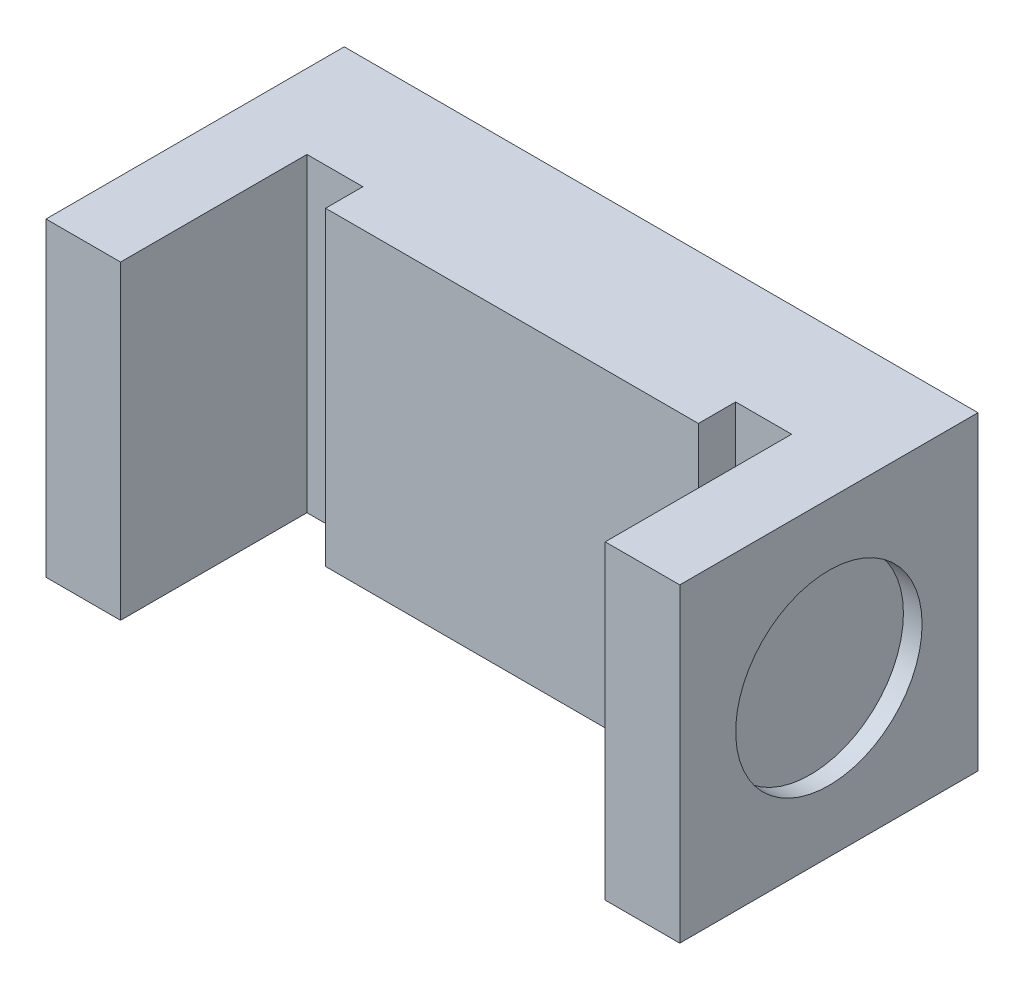
from build123d import *

# Parameters (mm, degrees)
SKETCH1_W           = 130
SKETCH1_H           = 83.238396624
BOSS_EXTRUDE1_DEPTH = 30
SKETCH2_W           = 100
SKETCH2_H           = 83.238396624
BOSS_EXTRUDE2_DEPTH = 10
SKETCH3_W           = 80
SKETCH3_H           = 83.238396624
BOSS_EXTRUDE3_DEPTH = 20
SKETCH4_R           = 25
CUT_EXTRUDE1_DEPTH  = 5
SKETCH5_W           = 80
SKETCH5_H           = 83.238396624
BOSS_EXTRUDE4_DEPTH = 20
CUT_EXTRUDE2_START  = -5
SKETCH6_R           = 25
CUT_EXTRUDE2_DEPTH  = 5
SKETCH7_W           = 80
SKETCH7_H           = 20
BOSS_EXTRUDE5_DEPTH = 5
SKETCH8_W           = 85
SKETCH8_H           = 50
BOSS_EXTRUDE6_DEPTH = 30
SKETCH9_W           = 85
SKETCH9_H           = 25
CUT_EXTRUDE3_DEPTH  = 15
SKETCH10_W          = 30
SKETCH10_H          = 15
CUT_EXTRUDE4_DEPTH  = 128.630488655


with BuildPart() as part:
    # Sketch1 → Boss-Extrude1 (new body)
    with BuildSketch(Plane.XY):
        Rectangle(SKETCH1_W, SKETCH1_H)
    extrude(amount=BOSS_EXTRUDE1_DEPTH)

    # Sketch2 → Boss-Extrude2 (add)
    with BuildSketch(Plane.XY.offset(30)):
        Rectangle(SKETCH2_W, SKETCH2_H)
    extrude(amount=BOSS_EXTRUDE2_DEPTH)

    # Sketch3 → Boss-Extrude3 (add)
    with BuildSketch(Plane.ZY.offset(65)):
        with Locations((40, 0)):
            Rectangle(SKETCH3_W, SKETCH3_H)
    extrude(amount=BOSS_EXTRUDE3_DEPTH)

    # Sketch4 → Cut-Extrude1 (cut)
    with BuildSketch(Plane.ZY.offset(85)):
        with Locations((40, 0)):
            Circle(SKETCH4_R)
    extrude(amount=-CUT_EXTRUDE1_DEPTH, mode=Mode.SUBTRACT)

    # Sketch5 → Boss-Extrude4 (add)
    with BuildSketch(Plane(origin=(65, 0, 0), x_dir=(0, 0, -1), z_dir=(1, 0, 0))):
        with Locations((-40, 0)):
            Rectangle(SKETCH5_W, SKETCH5_H)
    extrude(amount=BOSS_EXTRUDE4_DEPTH)

    # Sketch6 → Cut-Extrude2 (cut)
    with BuildSketch(Plane(origin=(85, 0, 0), x_dir=(0, 0, -1), z_dir=(1, 0, 0)).offset(CUT_EXTRUDE2_START)):
        with Locations(Location((-40, 0, 0), (0, 0, 180))):
            Circle(SKETCH6_R)
    extrude(amount=CUT_EXTRUDE2_DEPTH, mode=Mode.SUBTRACT)

    # Sketch7 → Boss-Extrude5 (add)
    with BuildSketch(Plane(origin=(0, 0, 0), x_dir=(-1, 0, 0), z_dir=(0, 0, -1))):
        with Locations((0, -41.619198312)):
            Rectangle(SKETCH7_W, SKETCH7_H)
    extrude(amount=BOSS_EXTRUDE5_DEPTH)

    # Sketch8 → Boss-Extrude6 (add)
    with BuildSketch(Plane(origin=(0, 0, 0), x_dir=(-1, 0, 0), z_dir=(0, 0, -1))):
        Rectangle(SKETCH8_W, SKETCH8_H)
    extrude(amount=BOSS_EXTRUDE6_DEPTH)

    # Sketch9 → Cut-Extrude3 (cut)
    with BuildSketch(Plane(origin=(0, 0, -30), x_dir=(-1, 0, 0), z_dir=(0, 0, -1))):
        with Locations((0, 12.5)):
            Rectangle(SKETCH9_W, SKETCH9_H)
    extrude(amount=-CUT_EXTRUDE3_DEPTH, mode=Mode.SUBTRACT)

    # Sketch10 → Cut-Extrude4 (cut, through all)
    with BuildSketch(Plane(origin=(0, 0, 0), x_dir=(1, 0, 0), z_dir=(0, 1, 0))):
        with Locations((-27.5, 22.5)):
            Rectangle(SKETCH10_W, SKETCH10_H)
        with Locations((27.5, 22.5)):
            Rectangle(SKETCH10_W, SKETCH10_H)
    extrude(amount=-CUT_EXTRUDE4_DEPTH, mode=Mode.SUBTRACT)


solid = part.part
